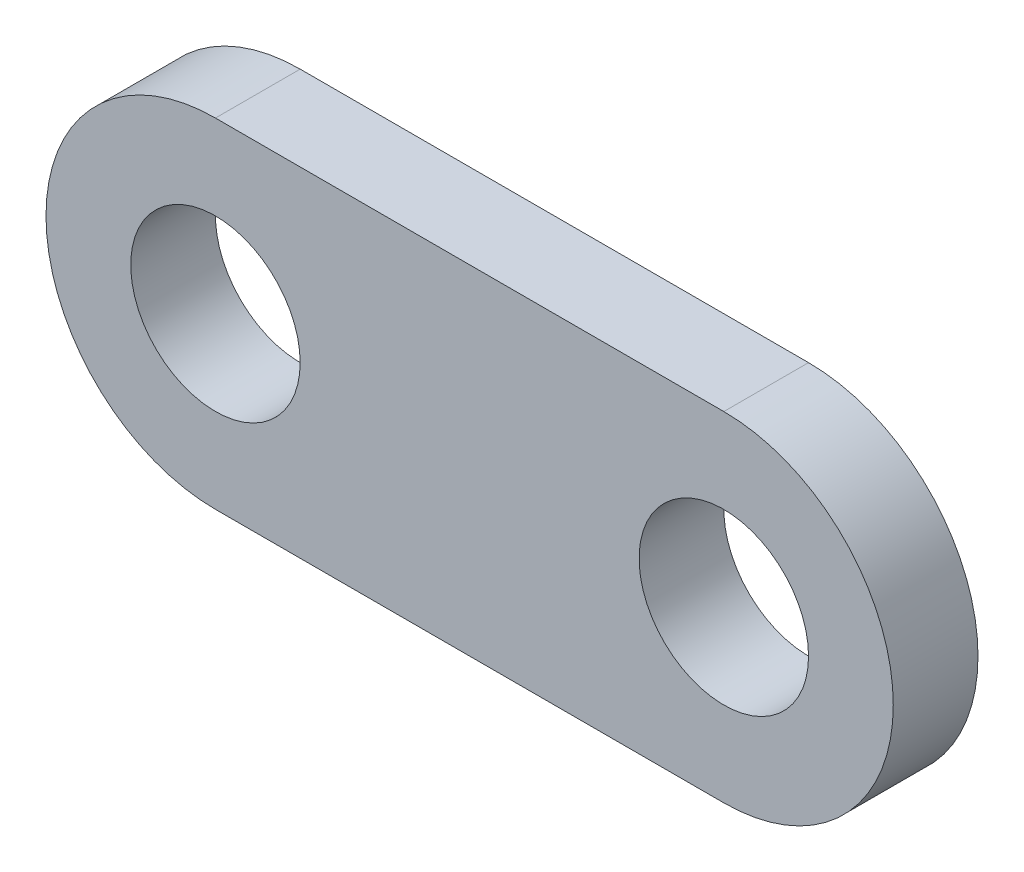
from build123d import *

# Parameters (mm, degrees)
ESBO_O1_R                = 5
RESSALTO_EXTRUS_O1_DEPTH = 5


with BuildPart() as part:
    # Esboço1 → Ressalto-extrusão1 (new body)
    with BuildSketch(Plane.XY):
        with BuildLine():
            Line((0, -10), (30, -10))
            ThreePointArc((30, -10), (40, 0), (30, 10))
            Line((30, 10), (0, 10))
            ThreePointArc((0, 10), (-10, 0), (0, -10))
        make_face()
        with Locations((30, 0)):
            Circle(ESBO_O1_R, mode=Mode.SUBTRACT)
        Circle(ESBO_O1_R, mode=Mode.SUBTRACT)
    extrude(amount=RESSALTO_EXTRUS_O1_DEPTH)


solid = part.part
